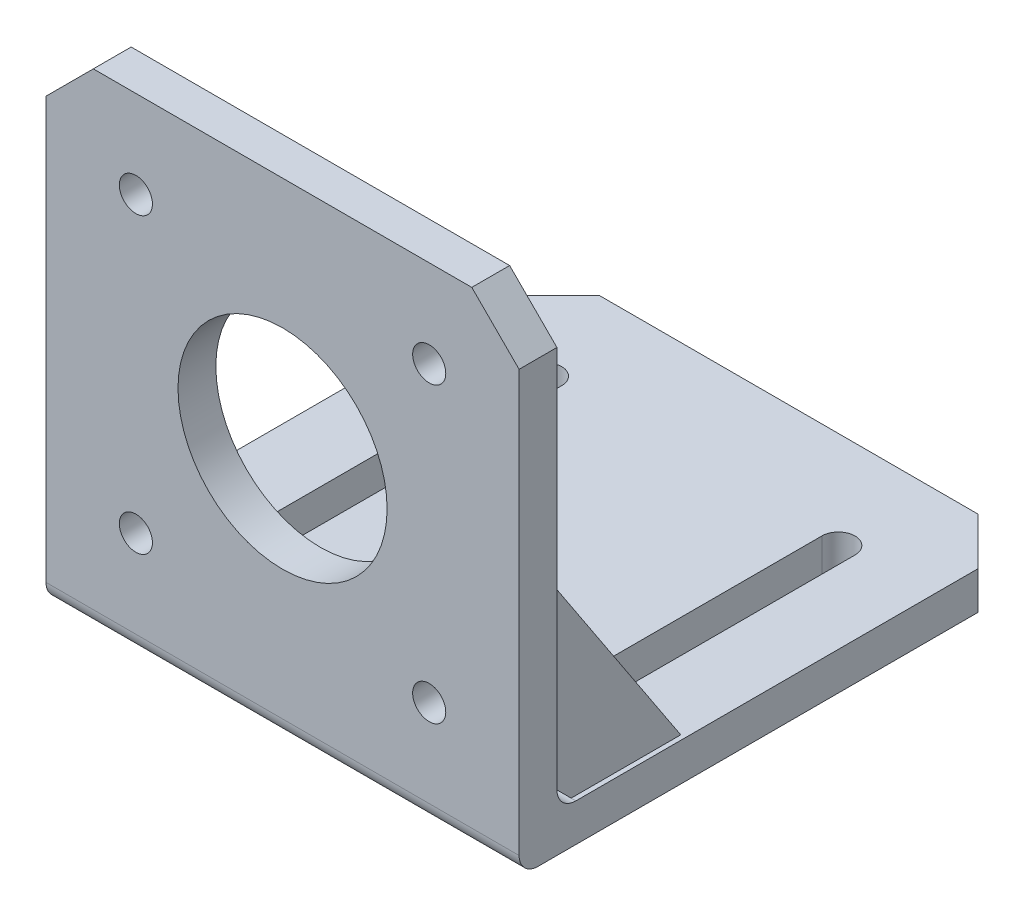
from build123d import *

# Parameters (mm, degrees)
SALIENTE_EXTRUIR1_DEPTH = 50
CROQUIS2_R              = 11.05
CROQUIS2_R_2            = 1.75
CORTAR_EXTRUIR1_DEPTH   = 90.523739868
CORTAR_EXTRUIR2_DEPTH   = 90.523739868
CHAFL_N1_SIZE           = 5
SALIENTE_EXTRUIR4_DEPTH = 2
SALIENTE_EXTRUIR5_DEPTH = 2


with BuildPart() as part:
    # Croquis1 → Saliente-Extruir1 (new body)
    with BuildSketch(Plane(origin=(0, 0, 0), x_dir=(0, 0, -1), z_dir=(1, 0, 0))):
        with BuildLine():
            Line((2, 0), (53.5, 0))
            Line((53.5, 0), (53.5, 4))
            Line((53.5, 4), (6, 4))
            ThreePointArc((6, 4), (4.585786438, 4.585786438), (4, 6))
            Line((4, 6), (4, 51.5))
            Line((4, 51.5), (0, 51.5))
            Line((0, 51.5), (0, 2))
            ThreePointArc((0, 2), (0.585786438, 0.585786438), (2, 0))
        make_face()
    extrude(amount=SALIENTE_EXTRUIR1_DEPTH)

    # Croquis2 → Cortar-Extruir1 (cut, through all)
    with BuildSketch(Plane.XY):
        with Locations((25, 26.75)):
            Circle(CROQUIS2_R)
        with Locations((9.5, 42.25)):
            Circle(CROQUIS2_R_2)
        with Locations((40.5, 42.25)):
            Circle(CROQUIS2_R_2)
        with Locations((9.5, 11.25)):
            Circle(CROQUIS2_R_2)
        with Locations((40.5, 11.25)):
            Circle(CROQUIS2_R_2)
    extrude(amount=-CORTAR_EXTRUIR1_DEPTH, mode=Mode.SUBTRACT)

    # Croquis3 → Cortar-Extruir2 (cut, through all)
    with BuildSketch(Plane.XZ):
        with BuildLine():
            Line((7.75, -12.25), (7.75, -43.25))
            ThreePointArc((7.75, -43.25), (9.5, -45), (11.25, -43.25))
            Line((11.25, -43.25), (11.25, -12.25))
            ThreePointArc((11.25, -12.25), (9.5, -10.5), (7.75, -12.25))
        make_face()
        with BuildLine():
            Line((38.75, -12.25), (38.75, -43.25))
            ThreePointArc((38.75, -43.25), (40.5, -45), (42.25, -43.25))
            Line((42.25, -43.25), (42.25, -12.25))
            ThreePointArc((42.25, -12.25), (40.5, -10.5), (38.75, -12.25))
        make_face()
    extrude(amount=-CORTAR_EXTRUIR2_DEPTH, mode=Mode.SUBTRACT)

    # Chaflán1
    chafl_n1_edges = [part.edges().sort_by_distance(p)[0] for p in [
        (0, 2, -53.5),
        (50, 51.5, -2),
        (50, 2, -53.5),
        (0, 51.5, -2),
    ]]
    chamfer(chafl_n1_edges, length=CHAFL_N1_SIZE)

    # Croquis6 → Saliente-Extruir4 (add)
    with BuildSketch(Plane(origin=(49.5, 0, 0), x_dir=(0, 0, -1), z_dir=(1, 0, 0))):
        Polygon((4, 24.585786438), (4, 6), (6, 4), (17.585786438, 4), align=None)
    extrude(amount=-SALIENTE_EXTRUIR4_DEPTH)

    # Croquis7 → Saliente-Extruir5 (add)
    with BuildSketch(Plane.ZY.offset(-0.5)):
        Polygon((-17.585786438, 4), (-4, 24.585786438), (-4, 6), (-6, 4), align=None)
    extrude(amount=-SALIENTE_EXTRUIR5_DEPTH)


solid = part.part
